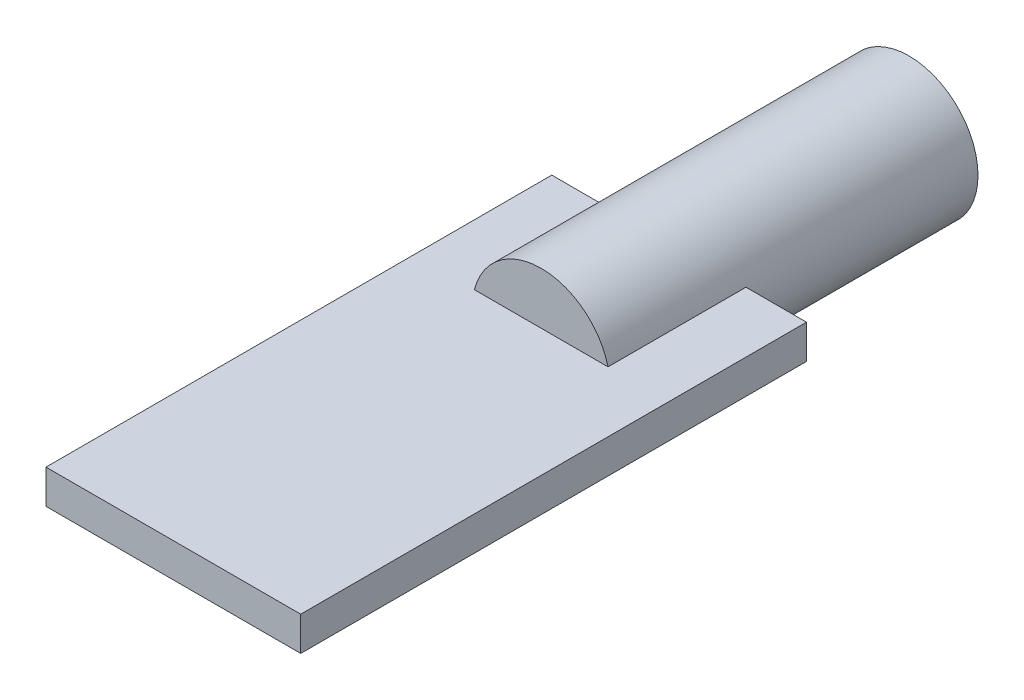
from build123d import *

# Parameters (mm, degrees)
SKETCH5_R           = 7.5
BOSS_EXTRUDE3_DEPTH = 40
SKETCH10_W          = 27.7
SKETCH10_H          = 3.7
CUT_EXTRUDE2_DEPTH  = 15
SKETCH11_W          = 27.7
SKETCH11_H          = 3.7
BOSS_EXTRUDE5_DEPTH = 55


with BuildPart() as part:
    # Sketch5 → Boss-Extrude3 (new body)
    with BuildSketch(Plane.XY):
        Circle(SKETCH5_R)
    extrude(amount=BOSS_EXTRUDE3_DEPTH)

    # Sketch10 → Cut-Extrude2 (cut)
    with BuildSketch(Plane.XY.offset(40)):
        Rectangle(SKETCH10_W, SKETCH10_H)
    extrude(amount=-CUT_EXTRUDE2_DEPTH, mode=Mode.SUBTRACT)

    # Sketch11 → Boss-Extrude5 (add)
    with BuildSketch(Plane.XY.offset(25)):
        Rectangle(SKETCH11_W, SKETCH11_H)
    extrude(amount=BOSS_EXTRUDE5_DEPTH)


solid = part.part
